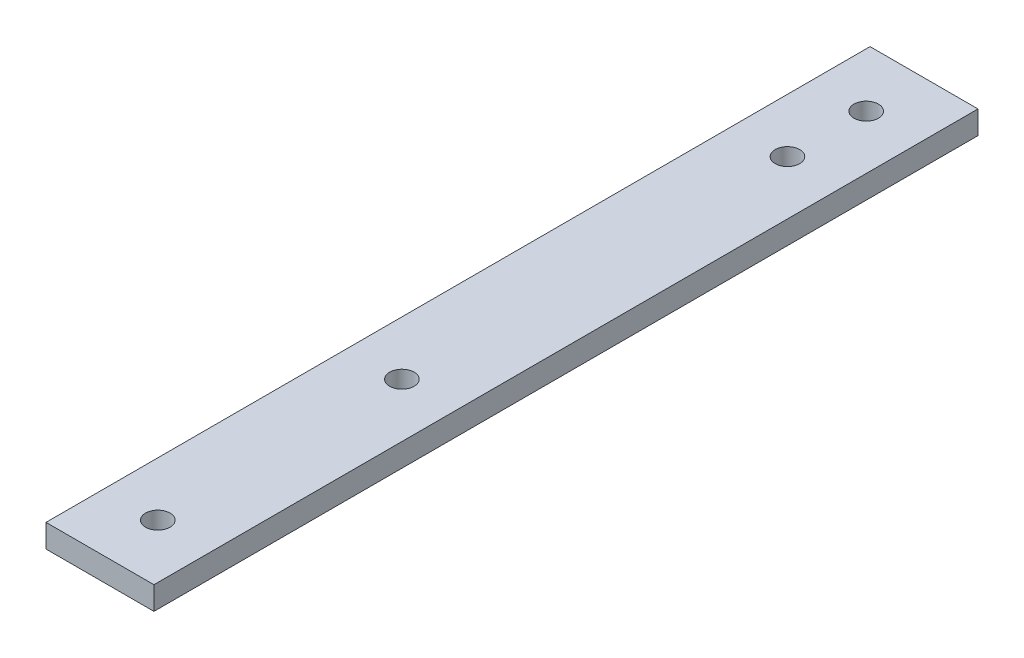
from build123d import *

# Parameters (mm, degrees)
SKETCH1_W      = 14
SKETCH1_H      = 106.86
EXTRUDE1_DEPTH = 3
SKETCH3_R      = 1.59
EXTRUDE3_DEPTH = 3


with BuildPart() as part:
    # Sketch1 → Extrude1 (new body)
    with BuildSketch(Plane(origin=(0, 0, 0), x_dir=(1, 0, 0), z_dir=(0, 1, 0))):
        with Locations((7, 53.43)):
            Rectangle(SKETCH1_W, SKETCH1_H)
    extrude(amount=EXTRUDE1_DEPTH)

    # Sketch3 → Extrude3 (cut)
    with BuildSketch(Plane(origin=(0, 3, 0), x_dir=(1, 0, 0), z_dir=(0, 1, 0))):
        with Locations(Location((7, 99.36, 0), (0, 0, 270))):
            Circle(SKETCH3_R)
        with Locations(Location((7, 7.5, 0), (0, 0, 90))):
            Circle(SKETCH3_R)
        with Locations(Location((7, 89.15, 0), (0, 0, 270))):
            Circle(SKETCH3_R)
        with Locations(Location((7, 39.15, 0), (0, 0, 270))):
            Circle(SKETCH3_R)
    extrude(amount=-EXTRUDE3_DEPTH, mode=Mode.SUBTRACT)


solid = part.part
